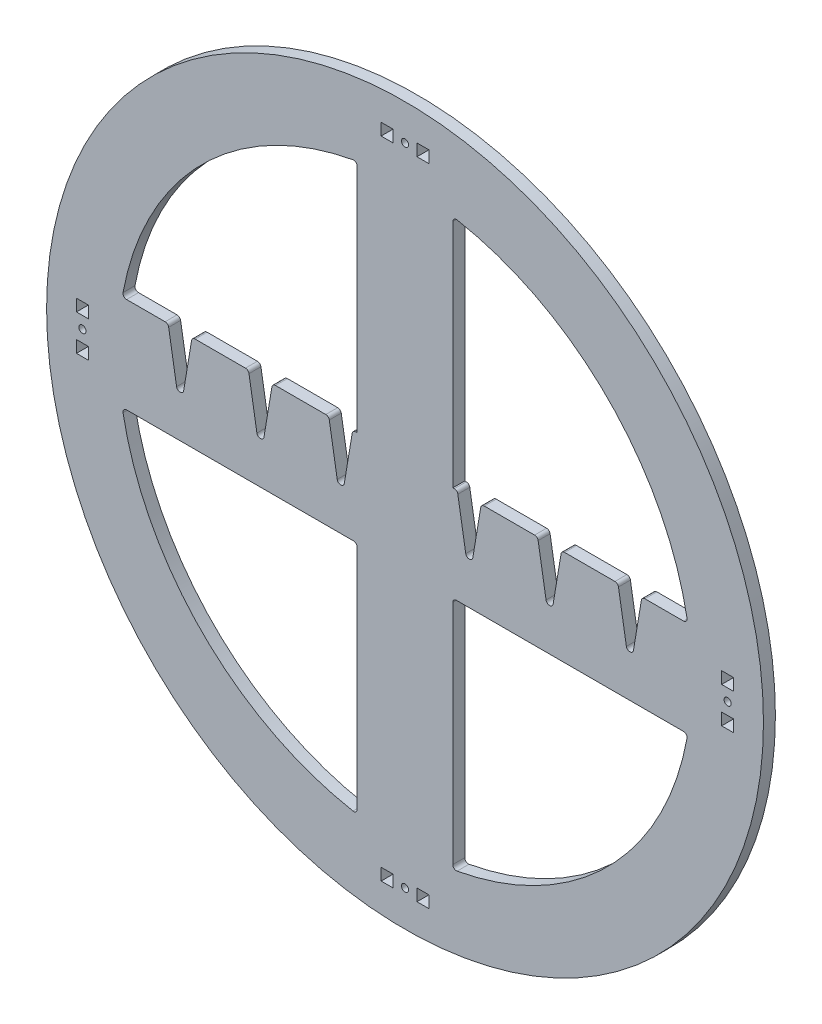
from build123d import *

# Parameters (mm, degrees)
ESQUISSE1_R        = 150
ESQUISSE1_R_2      = 1.5
ESQUISSE1_W        = 5
ESQUISSE1_H        = 5
BOSS_EXTRU_1_DEPTH = 5
CONG_1_R           = 1.5


with BuildPart() as part:
    # Esquisse1 → Boss.-Extru.1 (new body)
    with BuildSketch(Plane.XY):
        Circle(ESQUISSE1_R)
        with Locations((-135, 0)):
            Circle(ESQUISSE1_R_2, mode=Mode.SUBTRACT)
        with Locations((0, 135)):
            Circle(ESQUISSE1_R_2, mode=Mode.SUBTRACT)
        with Locations((135, 0)):
            Circle(ESQUISSE1_R_2, mode=Mode.SUBTRACT)
        with Locations((0, -135)):
            Circle(ESQUISSE1_R_2, mode=Mode.SUBTRACT)
        with BuildLine():
            Line((-20, 118.321595662), (-20, 20))
            Line((-20, 20), (-21.893135369, 20))
            Line((-21.893135369, 20), (-26.893135369, -10))
            Line((-26.893135369, -10), (-31.893135369, 20))
            Line((-31.893135369, 20), (-55.504004396, 20))
            Line((-55.504004396, 20), (-60.504004396, -10))
            Line((-60.504004396, -10), (-65.504004396, 20))
            Line((-65.504004396, 20), (-89.114873423, 20))
            Line((-89.114873423, 20), (-94.114873423, -10))
            Line((-94.114873423, -10), (-99.114873423, 20))
            Line((-99.114873423, 20), (-118.321595662, 20))
            ThreePointArc((-118.321595662, 20), (-84.852813742, 84.852813742), (-20, 118.321595662))
        make_face(mode=Mode.SUBTRACT)
        with BuildLine():
            Line((20, 118.321595662), (20, 20))
            Line((20, 20), (21.893135369, 20))
            Line((21.893135369, 20), (26.893135369, -10))
            Line((26.893135369, -10), (31.893135369, 20))
            Line((31.893135369, 20), (55.504004396, 20))
            Line((55.504004396, 20), (60.504004396, -10))
            Line((60.504004396, -10), (65.504004396, 20))
            Line((65.504004396, 20), (89.114873423, 20))
            Line((89.114873423, 20), (94.114873423, -10))
            Line((94.114873423, -10), (99.114873423, 20))
            Line((99.114873423, 20), (118.321595662, 20))
            ThreePointArc((118.321595662, 20), (84.852813742, 84.852813742), (20, 118.321595662))
        make_face(mode=Mode.SUBTRACT)
        with BuildLine():
            Line((118.321595662, -20), (20, -20))
            Line((20, -20), (20, -118.321595662))
            ThreePointArc((20, -118.321595662), (84.852813742, -84.852813742), (118.321595662, -20))
        make_face(mode=Mode.SUBTRACT)
        with BuildLine():
            Line((-20, -118.321595662), (-20, -20))
            Line((-20, -20), (-118.321595662, -20))
            ThreePointArc((-118.321595662, -20), (-84.852813742, -84.852813742), (-20, -118.321595662))
        make_face(mode=Mode.SUBTRACT)
        with Locations((-135, -7.5)):
            Rectangle(ESQUISSE1_W, ESQUISSE1_H, mode=Mode.SUBTRACT)
        with Locations((-135, 7.5)):
            Rectangle(ESQUISSE1_W, ESQUISSE1_H, mode=Mode.SUBTRACT)
        with Locations((-7.5, 135)):
            Rectangle(ESQUISSE1_W, ESQUISSE1_H, mode=Mode.SUBTRACT)
        with Locations((7.5, 135)):
            Rectangle(ESQUISSE1_W, ESQUISSE1_H, mode=Mode.SUBTRACT)
        with Locations((135, 7.5)):
            Rectangle(ESQUISSE1_W, ESQUISSE1_H, mode=Mode.SUBTRACT)
        with Locations((135, -7.5)):
            Rectangle(ESQUISSE1_W, ESQUISSE1_H, mode=Mode.SUBTRACT)
        with Locations((7.5, -135)):
            Rectangle(ESQUISSE1_W, ESQUISSE1_H, mode=Mode.SUBTRACT)
        with Locations((-7.5, -135)):
            Rectangle(ESQUISSE1_W, ESQUISSE1_H, mode=Mode.SUBTRACT)
    extrude(amount=BOSS_EXTRU_1_DEPTH)

    # Congé1
    cong_1_edges = [part.edges().sort_by_distance(p)[0] for p in [
        (-20, -20, 2.5),
        (-118.321595662, -20, 2.5),
        (-20, -118.321595662, 2.5),
        (20, -20, 2.5),
        (20, -118.321595662, 2.5),
        (118.321595662, -20, 2.5),
        (21.893135369, 20, 2.5),
        (26.893135369, -10, 2.5),
        (31.893135369, 20, 2.5),
        (55.504004396, 20, 2.5),
        (60.504004396, -10, 2.5),
        (65.504004396, 20, 2.5),
        (89.114873423, 20, 2.5),
        (94.114873423, -10, 2.5),
        (99.114873423, 20, 2.5),
        (118.321595662, 20, 2.5),
        (20, 118.321595662, 2.5),
        (-99.114873423, 20, 2.5),
        (-94.114873423, -10, 2.5),
        (-89.114873423, 20, 2.5),
        (-65.504004396, 20, 2.5),
        (-60.504004396, -10, 2.5),
        (-55.504004396, 20, 2.5),
        (-31.893135369, 20, 2.5),
        (-26.893135369, -10, 2.5),
        (-21.893135369, 20, 2.5),
        (-20, 118.321595662, 2.5),
        (-118.321595662, 20, 2.5),
    ]]
    fillet(cong_1_edges, radius=CONG_1_R)


solid = part.part
